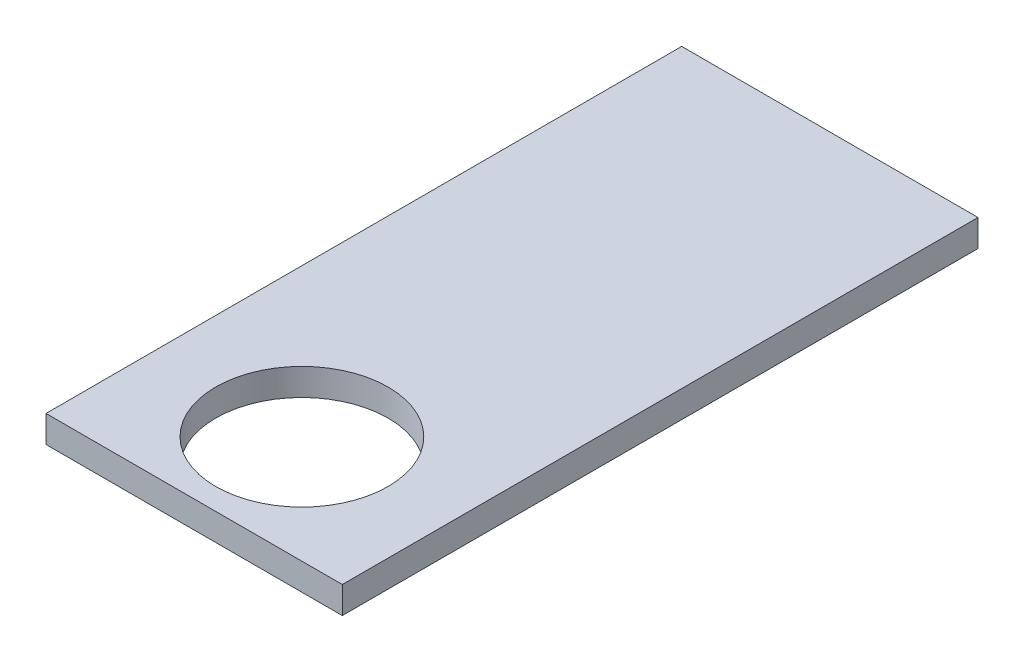
from build123d import *

# Parameters (mm, degrees)
SKETCH1_W           = 55
SKETCH1_H           = 118
SKETCH1_R           = 16
BOSS_EXTRUDE1_DEPTH = 5


with BuildPart() as part:
    # Sketch1 → Boss-Extrude1 (new body)
    with BuildSketch(Plane(origin=(0, 0, 0), x_dir=(1, 0, 0), z_dir=(0, 1, 0))):
        Rectangle(SKETCH1_W, SKETCH1_H)
        with Locations(Location((0, -39, 0), (0, 0, 270))):
            Circle(SKETCH1_R, mode=Mode.SUBTRACT)
    extrude(amount=BOSS_EXTRUDE1_DEPTH)


solid = part.part
